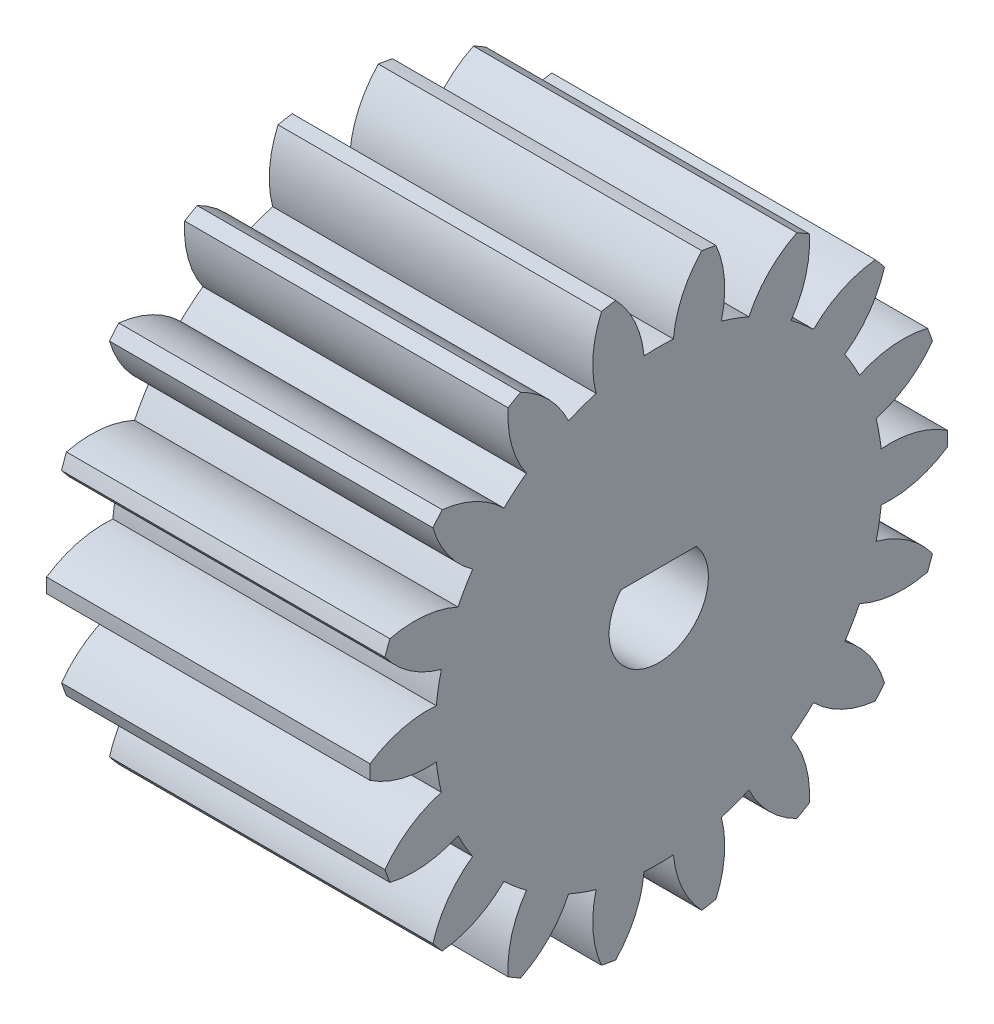
from build123d import *

# Parameters (mm, degrees)
BASPROSKE_W           = 14
BASPROSKE_H           = 12.5
TOOTHCUT_DEPTH        = 23.549944568
TEETHCUTS_COUNT       = 18
BORSKE_R              = 0.4
BORE_DEPTH            = 50.0000508
CORTAR_EXTRUIR1_REACH = 24.473


with BuildPart() as part:
    # BasProSke → Base-Revolve (revolve)
    with BuildSketch(Plane(origin=(0, 0, 0), x_dir=(1, 0, 0), z_dir=(0, 1, 0)), mode=Mode.PRIVATE) as base_revolve_sk:
        with Locations((7, 6.25)):
            Rectangle(BASPROSKE_W, BASPROSKE_H)
    revolve(base_revolve_sk.sketch.rotate(Axis((-10, 0, 0), (1, 0, 0)), 180), axis=Axis((-10, 0, 0), (1, 0, 0)))

    # TooCutSke → ToothCut (cut, through all)
    with BuildSketch(Plane(origin=(0, 0, 0), x_dir=(0, 0, -1), z_dir=(1, 0, 0))):
        with BuildLine():
            ThreePointArc((0.634554124, 9.665693111), (0, 9.6865), (-0.634554124, 9.665693111))
            ThreePointArc((-0.634554124, 9.665693111), (-1.026818848, 11.131124412), (-1.883745888, 12.38293772))
            ThreePointArc((-1.883745888, 12.38293772), (0, 12.5254), (1.883745888, 12.38293772))
            ThreePointArc((1.883745888, 12.38293772), (1.026818848, 11.131124412), (0.634554124, 9.665693111))
        make_face()
    toothcut = extrude(amount=TOOTHCUT_DEPTH, mode=Mode.SUBTRACT)

    # TeethCuts: ToothCut ×18 about axis
    teethcuts_axis = Axis((0, 0, 0), (1, 0, 0))
    for i in range(1, TEETHCUTS_COUNT):
        add(toothcut.rotate(teethcuts_axis, i * 360 / TEETHCUTS_COUNT), mode=Mode.SUBTRACT)

    # BorSke → Bore (cut, symmetric)
    with BuildSketch(Plane(origin=(0, 0, 0), x_dir=(0, 0, -1), z_dir=(1, 0, 0))):
        with Locations(Location((0, 0, 0), (0, 0, 180))):
            Circle(BORSKE_R)
    extrude(amount=BORE_DEPTH, both=True, mode=Mode.SUBTRACT)

    # Croquis1 → Cortar-Extruir1 (cut, up to next)
    with BuildSketch(Plane(origin=(14, 0, 0), x_dir=(0, 0, -1), z_dir=(1, 0, 0)), mode=Mode.PRIVATE) as cortar_extruir1_sk1:
        with BuildLine():
            Line((1.631716887, 1.4), (-1.631716887, 1.4))
            ThreePointArc((-1.631716887, 1.4), (-0.746427723, -2.016270233), (2.15, 0))
            ThreePointArc((2.15, 0), (2.016270233, 0.746427723), (1.631716887, 1.4))
        make_face()
    cortar_extruir1_tool1 = extrude(cortar_extruir1_sk1.sketch, amount=-CORTAR_EXTRUIR1_REACH, mode=Mode.PRIVATE) & part.part
    add(cortar_extruir1_tool1.solids().sort_by_distance((14, -0.225862, 0))[0], mode=Mode.SUBTRACT)


solid = part.part
